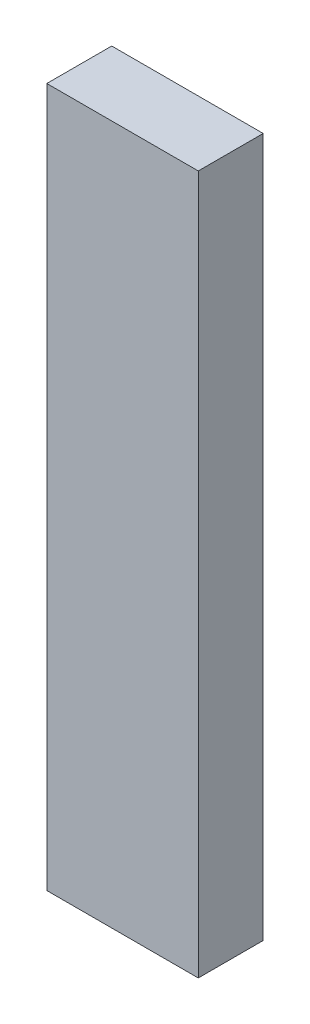
from build123d import *

# Parameters (mm, degrees)
SKETCH1_W           = 7
SKETCH1_H           = 32.3
BOSS_EXTRUDE1_DEPTH = 3


with BuildPart() as part:
    # Sketch1 → Boss-Extrude1 (new body)
    with BuildSketch(Plane.XY):
        Rectangle(SKETCH1_W, SKETCH1_H)
    extrude(amount=BOSS_EXTRUDE1_DEPTH)


solid = part.part
